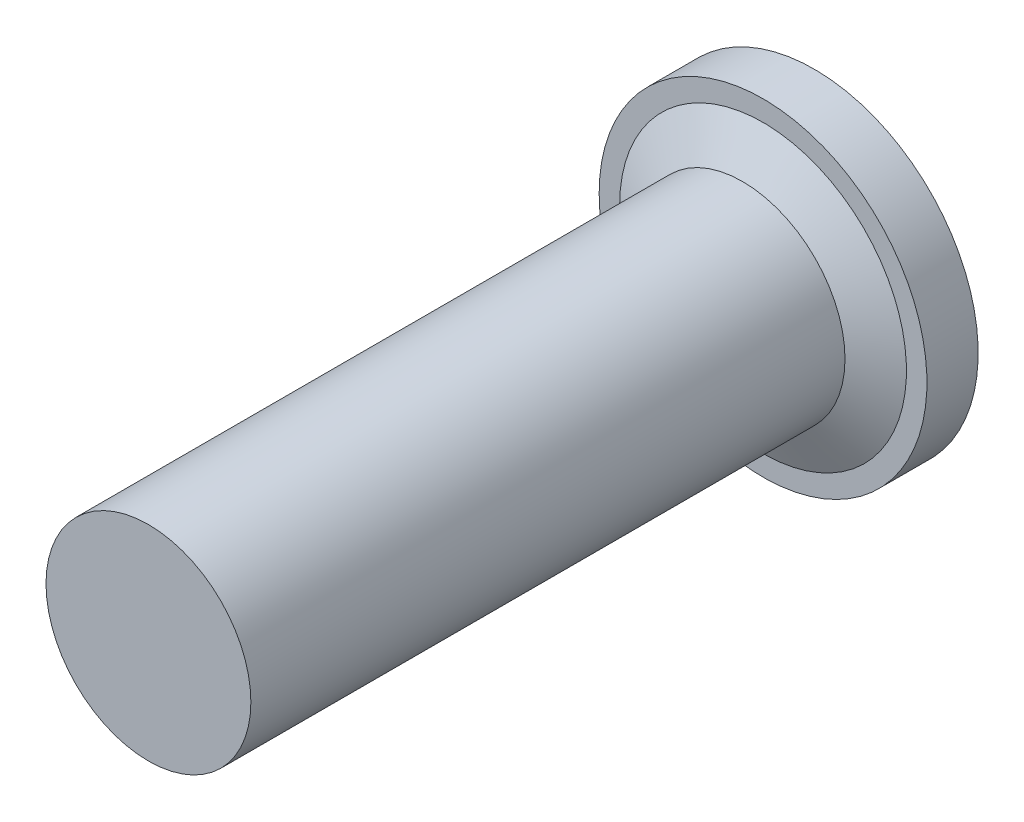
from build123d import *


with BuildPart() as part:
    # Sketch1 → Revolve2 (revolve)
    with BuildSketch(Plane(origin=(0, 0, 0), x_dir=(1, 0, 0), z_dir=(0, 1, 0)), mode=Mode.PRIVATE) as revolve2_sk:
        Polygon((0, 300.906470221), (203.2, 300.906470221), (203.2, 237.406470221), (177.8, 237.406470221), (127, 212.006470221), (127, -524.593529779), (0, -524.593529779), align=None)
    revolve(revolve2_sk.sketch.rotate(Axis((0, 0, -338.816637037), (0, 0, 1)), 180), axis=Axis((0, 0, -338.816637037), (0, 0, 1)))


solid = part.part
